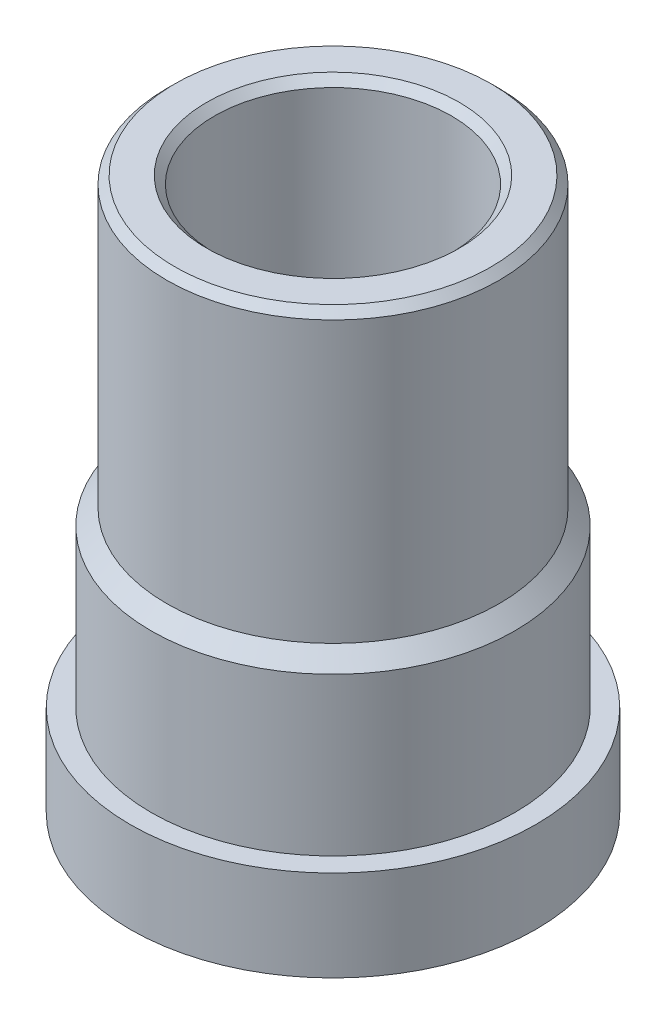
from build123d import *


with BuildPart() as part:
    # Эскиз1 → Повернуть1 (revolve)
    with BuildSketch(Plane.XY, mode=Mode.PRIVATE) as revolve_1_sk:
        Polygon((0, 0), (0.915, 0), (0.915, 0.41), (0.820710678, 0.41), (0.820710678, 1.12), (0.75, 1.190710678), (0.75, 2.454644661), (0.714644661, 2.49), (0.570355339, 2.49), (0.535, 2.454644661), (0.535, 1.495781623), (0, 1.495781623), align=None)
    revolve(revolve_1_sk.sketch.rotate(Axis((0, 0, 0), (0, 1, 0)), 90), axis=Axis((0, 0, 0), (0, 1, 0)))


solid = part.part
